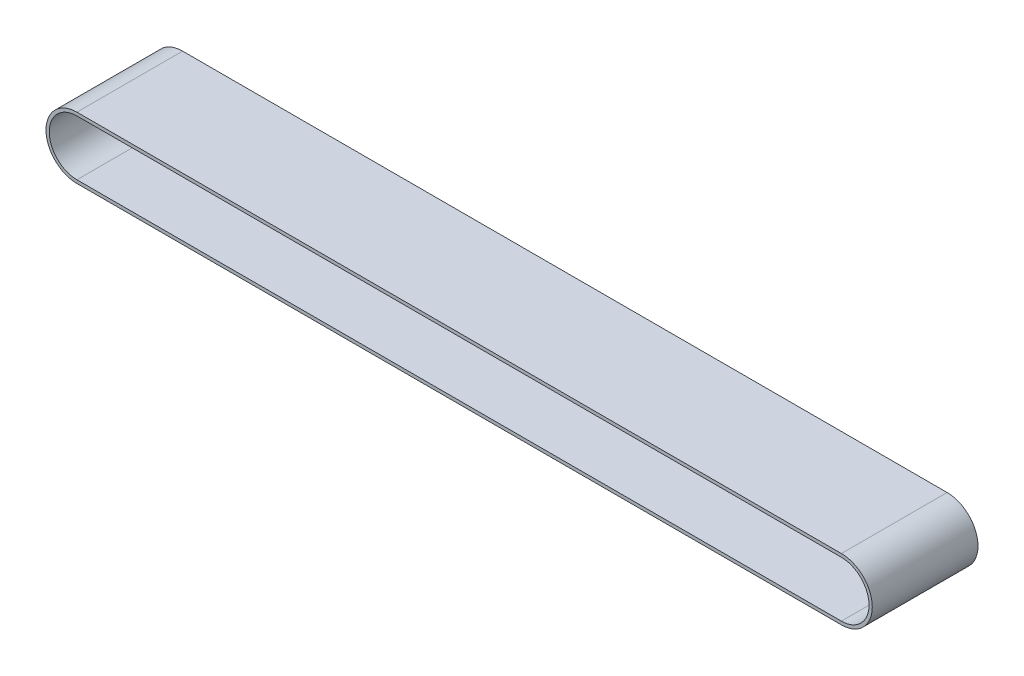
from build123d import *

# Parameters (mm, degrees)
BOSS_EXTRUDE1_DEPTH = 65
CUT_EXTRUDE1_DEPTH  = 150
BOSS_EXTRUDE2_DEPTH = 65
CUT_EXTRUDE2_DEPTH  = 168
BOSS_EXTRUDE4_DEPTH = 65
CUT_EXTRUDE3_DEPTH  = 225
CUT_EXTRUDE4_DEPTH  = 225


with BuildPart() as part:
    # Sketch1 → Boss-Extrude1 (new body)
    with BuildSketch(Plane.XY):
        with BuildLine():
            Line((0, 18), (470, 18))
            ThreePointArc((470, 18), (488, 0), (470, -18))
            Line((470, -18), (0, -18))
            ThreePointArc((0, -18), (-18, 0), (0, 18))
        make_face()
    extrude(amount=BOSS_EXTRUDE1_DEPTH)

    # Sketch2 → Cut-Extrude1 (cut)
    with BuildSketch(Plane.XY.offset(65)):
        with BuildLine():
            Line((0, -16), (470, -16))
            ThreePointArc((470, -16), (486, 0), (470, 16))
            Line((470, 16), (0, 16))
            ThreePointArc((0, 16), (-16, 0), (0, -16))
        make_face()
    extrude(amount=-CUT_EXTRUDE1_DEPTH, mode=Mode.SUBTRACT)

    # Sketch3 → Boss-Extrude2 (add)
    with BuildSketch(Plane.XY.offset(65)):
        with BuildLine():
            Line((0, -20), (470, -20))
            ThreePointArc((470, -20), (490, 0), (470, 20))
            Line((470, 20), (0, 20))
            ThreePointArc((0, 20), (-20, 0), (0, -20))
        make_face()
    extrude(amount=-BOSS_EXTRUDE2_DEPTH)

    # Sketch4 → Cut-Extrude2 (cut)
    with BuildSketch(Plane.XY.offset(65)):
        with BuildLine():
            Line((0, -18), (470, -18))
            ThreePointArc((470, -18), (488, 0), (470, 18))
            Line((470, 18), (0, 18))
            ThreePointArc((0, 18), (-18, 0), (0, -18))
        make_face()
    extrude(amount=-CUT_EXTRUDE2_DEPTH, mode=Mode.SUBTRACT)

    # Sketch5 → Boss-Extrude4 (add)
    with BuildSketch(Plane.XY.offset(65)):
        with BuildLine():
            Line((0, -18), (470, -18))
            ThreePointArc((470, -18), (488, 0), (470, 18))
            Line((470, 18), (0, 18))
            ThreePointArc((0, 18), (-18, 0), (0, -18))
        make_face()
    extrude(amount=-BOSS_EXTRUDE4_DEPTH)

    # Sketch7 → Cut-Extrude3 (cut)
    with BuildSketch(Plane.XY.offset(65)):
        with BuildLine():
            Line((0, -17), (470, -17))
            ThreePointArc((470, -17), (487, 0), (470, 17))
            Line((470, 17), (0, 17))
            ThreePointArc((0, 17), (-17, 0), (0, -17))
        make_face()
    extrude(amount=-CUT_EXTRUDE3_DEPTH, mode=Mode.SUBTRACT)

    # Sketch8 → Cut-Extrude4 (cut)
    with BuildSketch(Plane.XY.offset(65)):
        with BuildLine():
            Line((0, 20), (470, 20))
            ThreePointArc((470, 20), (490, 0), (470, -20))
            Line((470, -20), (0, -20))
            ThreePointArc((0, -20), (-20, 0), (0, 20))
        make_face()
        with BuildLine():
            Line((0, 19), (470, 19))
            ThreePointArc((470, 19), (489, 0), (470, -19))
            Line((470, -19), (0, -19))
            ThreePointArc((0, -19), (-19, 0), (0, 19))
        make_face(mode=Mode.SUBTRACT)
    extrude(amount=-CUT_EXTRUDE4_DEPTH, mode=Mode.SUBTRACT)


solid = part.part
